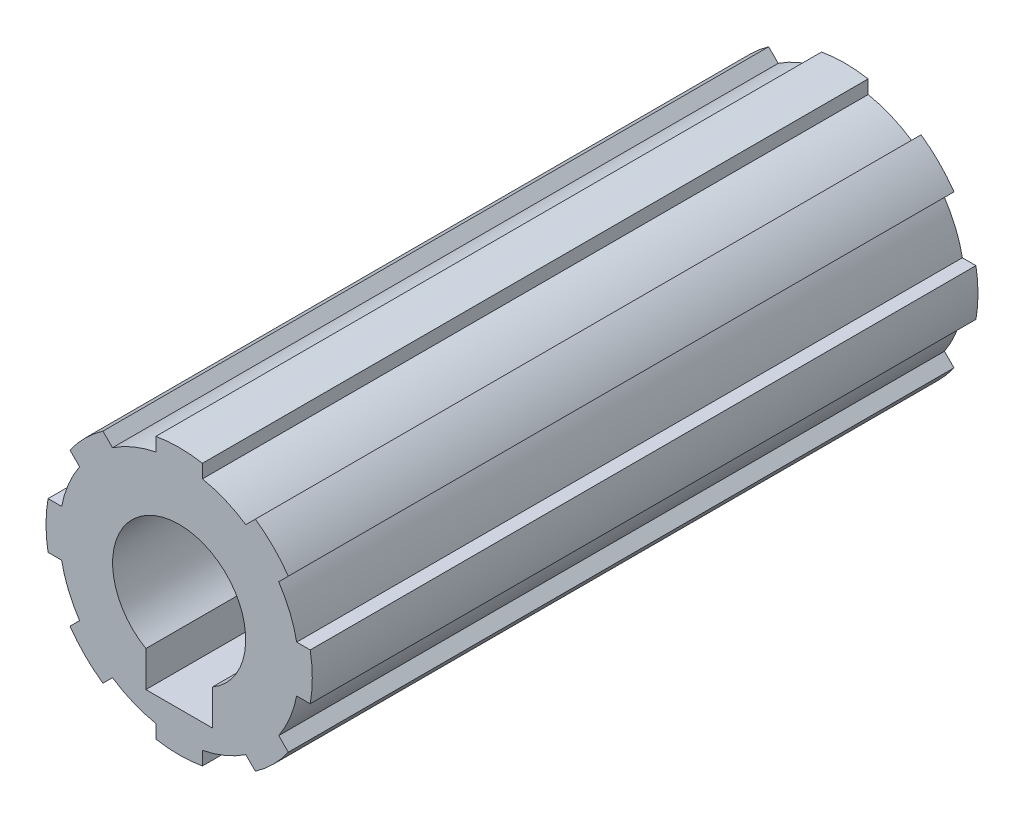
from build123d import *

# Parameters (mm, degrees)
SKETCH1_R           = 18
BASEKEY_DEPTH       = 50
RECTANGLE_DEPTH     = 50
RECTANGLEPAT_COUNT  = 8
SKETCH_1_R          = 10
CUT_EXTRUDE_1_DEPTH = 22
CUT_EXTRUDE_2_DEPTH = 14


with BuildPart() as part:
    # Sketch1 → BaseKey (new, symmetric)
    with BuildSketch(Plane.XY):
        Circle(SKETCH1_R)
    extrude(amount=BASEKEY_DEPTH, both=True)

    # Sketch2 → Rectangle (add, symmetric)
    with BuildSketch(Plane.XY):
        with BuildLine():
            Line((-3.5, 19.691368668), (-3.5, 0))
            Line((-3.5, 0), (3.5, 0))
            Line((3.5, 0), (3.5, 19.691368668))
            ThreePointArc((3.5, 19.691368668), (0, 20), (-3.5, 19.691368668))
        make_face()
    rectangle = extrude(amount=RECTANGLE_DEPTH, both=True)

    # RectanglePat: Rectangle ×8 about axis
    rectanglepat_axis = Axis((0, 0, 0), (0, 0, 1))
    for i in range(1, RECTANGLEPAT_COUNT):
        add(rectangle.rotate(rectanglepat_axis, i * 360 / RECTANGLEPAT_COUNT))

    # 草图1 → 切除-拉伸1 (cut)
    with BuildSketch(Plane.XY.offset(50)):
        Circle(SKETCH_1_R)
    extrude(amount=-CUT_EXTRUDE_1_DEPTH, mode=Mode.SUBTRACT)

    # 草图2 → 切除-拉伸2 (cut)
    with BuildSketch(Plane(origin=(0, 0, 0), x_dir=(1, 0, 0), z_dir=(0, 1, 0))):
        Polygon((0, -50), (5, -50), (5, -43), (5, -36), (5, -28), (-5, -28), (-5, -36), (-5, -43), (-5, -50), align=None)
    extrude(amount=-CUT_EXTRUDE_2_DEPTH, mode=Mode.SUBTRACT)


solid = part.part
